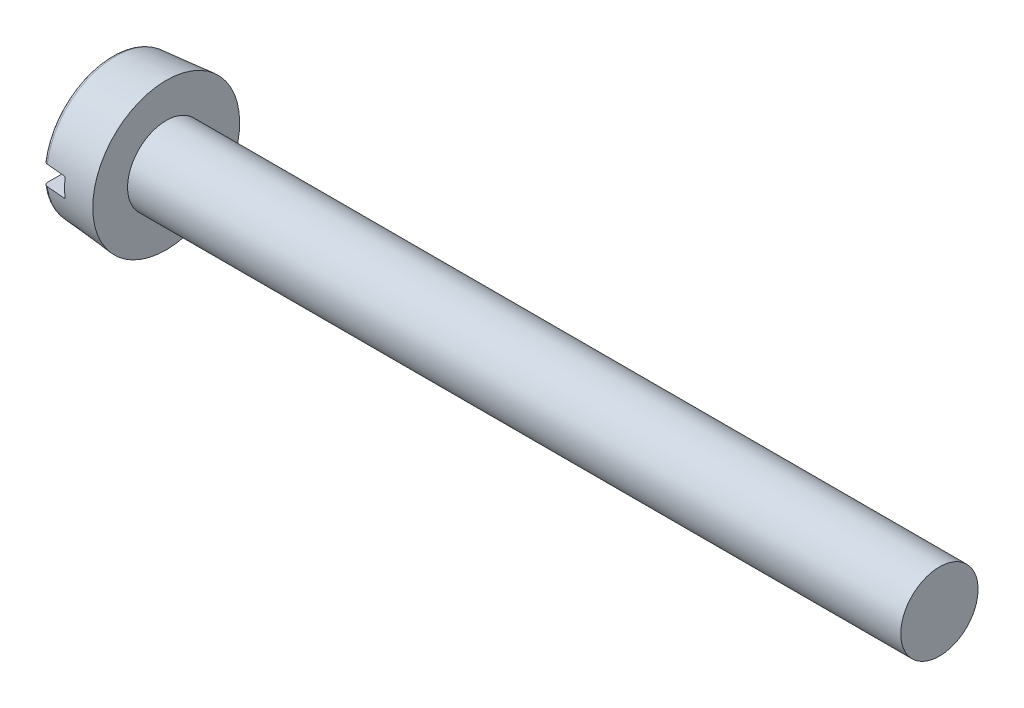
from build123d import *

# Parameters (mm, degrees)
FILLET2_R  = 0.1
SKETCH2_W  = 3.8
SKETCH2_H  = 0.5
SLOT_DEPTH = 0.6


with BuildPart() as part:
    # BodySke → Base-Revolve (revolve)
    with BuildSketch(Plane.XY, mode=Mode.PRIVATE) as base_revolve_sk:
        Polygon((1.4, 1), (1.4, 1.9), (0, 1.777515871), (0, 0), (21.4, 0), (21.4, 1), align=None)
    revolve(base_revolve_sk.sketch.rotate(Axis((-25.4, 0, 0), (1, 0, 0)), 90), axis=Axis((-25.4, 0, 0), (1, 0, 0)))

    # Fillet2
    fillet2_edges = [part.edges().sort_by_distance(p)[0] for p in [
        (0, 0, -1.777515871),
    ]]
    fillet(fillet2_edges, radius=FILLET2_R)

    # Sketch2 → Slot (cut)
    with BuildSketch(Plane(origin=(0, 0, 0), x_dir=(0, 0, -1), z_dir=(1, 0, 0))):
        Rectangle(SKETCH2_W, SKETCH2_H)
    extrude(amount=SLOT_DEPTH, mode=Mode.SUBTRACT)


solid = part.part
